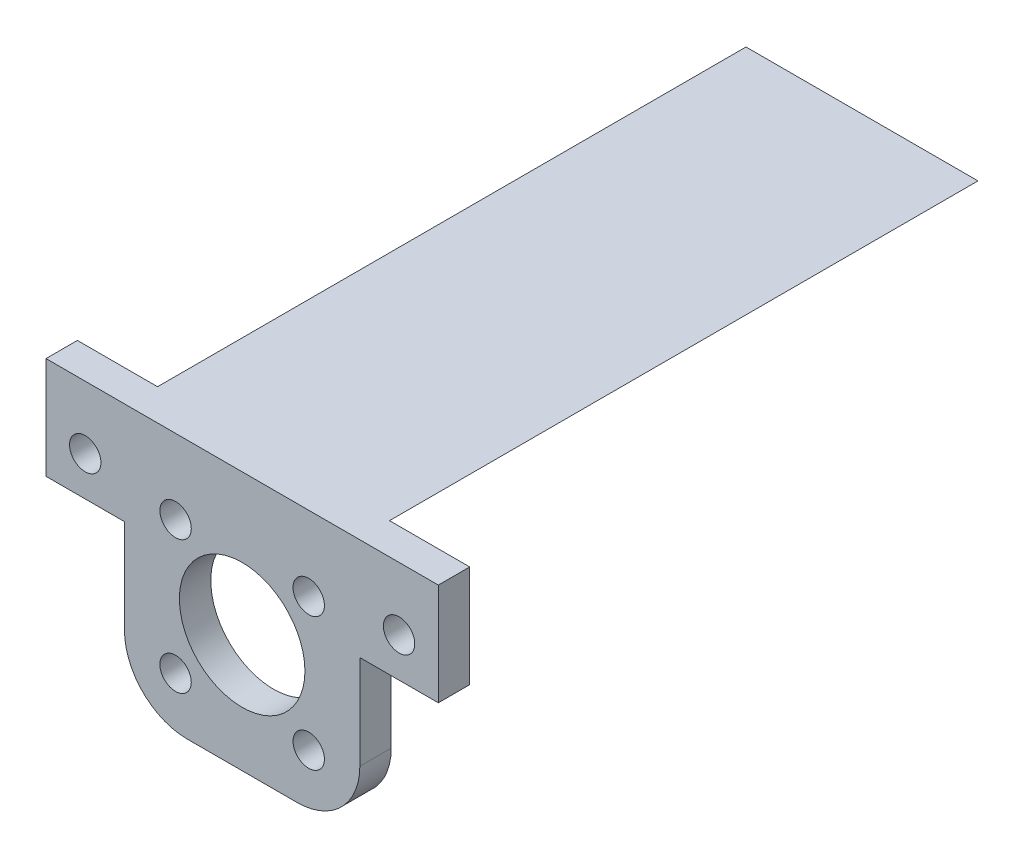
from build123d import *

# Parameters (mm, degrees)
CROQUIS1_R              = 8
CROQUIS1_R_2            = 2
SALIENTE_EXTRUIR1_DEPTH = 4
SALIENTE_EXTRUIR2_DEPTH = 75


with BuildPart() as part:
    # Croquis1 → Saliente-Extruir1 (new body)
    with BuildSketch(Plane.XY):
        with BuildLine():
            Line((-25, 33), (25, 33))
            Line((25, 33), (25, 20))
            Line((25, 20), (15, 20))
            Line((15, 20), (15, 8))
            ThreePointArc((15, 8), (12.656854249, 2.343145751), (7, 0))
            Line((7, 0), (-7, 0))
            ThreePointArc((-7, 0), (-12.656854249, 2.343145751), (-15, 8))
            Line((-15, 8), (-15, 20))
            Line((-15, 20), (-25, 20))
            Line((-25, 20), (-25, 33))
        make_face()
        with Locations((0, 15)):
            Circle(CROQUIS1_R, mode=Mode.SUBTRACT)
        with Locations((-8.485281374, 6.514718626)):
            Circle(CROQUIS1_R_2, mode=Mode.SUBTRACT)
        with Locations((-8.485281374, 23.485281374)):
            Circle(CROQUIS1_R_2, mode=Mode.SUBTRACT)
        with Locations((-20, 25)):
            Circle(CROQUIS1_R_2, mode=Mode.SUBTRACT)
        with Locations(Location((8.485281374, 6.514718626, 0), (0, 0, 180))):
            Circle(CROQUIS1_R_2, mode=Mode.SUBTRACT)
        with Locations(Location((8.485281374, 23.485281374, 0), (0, 0, 180))):
            Circle(CROQUIS1_R_2, mode=Mode.SUBTRACT)
        with Locations(Location((20, 25, 0), (0, 0, 180))):
            Circle(CROQUIS1_R_2, mode=Mode.SUBTRACT)
    extrude(amount=SALIENTE_EXTRUIR1_DEPTH)

    # Croquis2 → Saliente-Extruir2 (add)
    with BuildSketch(Plane(origin=(0, 0, 0), x_dir=(-1, 0, 0), z_dir=(0, 0, -1))):
        Polygon((14.783431943, 33), (-14.783431943, 33), (-9.020485562, 30), (9.020485562, 30), align=None)
    extrude(amount=SALIENTE_EXTRUIR2_DEPTH)


solid = part.part
